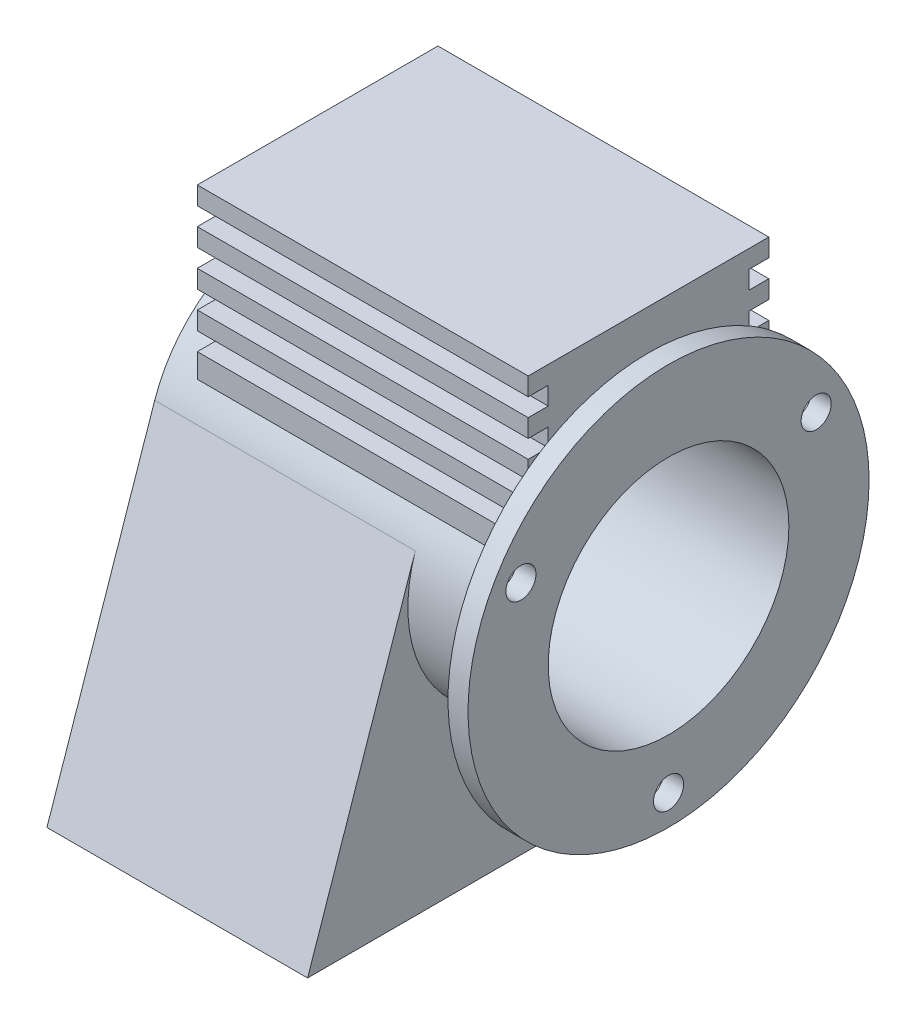
from build123d import *
from build123d.topology import SkipClean

# Parameters (mm, degrees)
BOSS_EXTRUDE1_DEPTH     = 165.1
SKETCH2_R               = 88.9
BOSS_EXTRUDE2_DEPTH     = 228.6
SKETCH3_R               = 127
BOSS_EXTRUDE3_DEPTH     = 12.7
SKETCH4_W               = 152.4
SKETCH4_H               = 152.4
BOSS_EXTRUDE4_DEPTH     = 209.55
SKETCH5_W               = 25.4
SKETCH5_H               = 11.43
CUT_EXTRUDE1_DEPTH      = 209.55
LPATTERN1_COUNT         = 4
LPATTERN1_PITCH         = 22.86
MIRROR1_COPY_1_SKETCH_W = 25.4
MIRROR1_COPY_1_SKETCH_H = 11.43
MIRROR1_COPY_1_DEPTH    = 209.55
MIRROR1_COPY_2_SKETCH_W = 25.4
MIRROR1_COPY_2_SKETCH_H = 11.43
MIRROR1_COPY_2_DEPTH    = 209.55
MIRROR1_COPY_3_SKETCH_W = 25.4
MIRROR1_COPY_3_SKETCH_H = 11.43
MIRROR1_COPY_3_DEPTH    = 209.55
SKETCH7_R               = 76.2
CUT_EXTRUDE2_DEPTH      = 228.6
SKETCH8_R               = 19.05
CUT_EXTRUDE3_DEPTH      = 228.6
SKETCH9_R               = 9.525
CUT_EXTRUDE5_DEPTH      = 50.8


with BuildPart() as part:
    # Sketch1 → Boss-Extrude1 (new body)
    with BuildSketch(Plane(origin=(0, 0, 0), x_dir=(0, 0, -1), z_dir=(1, 0, 0))):
        with BuildLine():
            Line((-152.4, -171.45), (152.4, -171.45))
            Line((152.4, -171.45), (84.14126771, 28.695941668))
            ThreePointArc((84.14126771, 28.695941668), (0, 88.9), (-84.14126771, 28.695941668))
            Line((-84.14126771, 28.695941668), (-152.4, -171.45))
        make_face()
    extrude(amount=BOSS_EXTRUDE1_DEPTH)

    # Sketch2 → Boss-Extrude2 (add)
    with SkipClean():  # the faces are left unmerged after this step: merging them gives an invalid solid
        with BuildSketch(Plane.ZY):
            Circle(SKETCH2_R)
        extrude(amount=-BOSS_EXTRUDE2_DEPTH)

    # Sketch3 → Boss-Extrude3 (add)
    with BuildSketch(Plane(origin=(228.6, 0, 0), x_dir=(0, 0, -1), z_dir=(1, 0, 0))):
        Circle(SKETCH3_R)
    extrude(amount=BOSS_EXTRUDE3_DEPTH)

    # Sketch4 → Boss-Extrude4 (add)
    with BuildSketch(Plane.ZY.offset(-228.6)):
        with Locations((0, 76.2)):
            Rectangle(SKETCH4_W, SKETCH4_H)
    extrude(amount=BOSS_EXTRUDE4_DEPTH)

    # Sketch5 → Cut-Extrude1 (cut)
    with BuildSketch(Plane.ZY.offset(-19.05)):
        with Locations((-76.2, 135.255)):
            Rectangle(SKETCH5_W, SKETCH5_H)
    cut_extrude1 = extrude(amount=-CUT_EXTRUDE1_DEPTH, mode=Mode.SUBTRACT)

    # LPattern1: Cut-Extrude1 ×4
    with Locations(*[(0, -i * LPATTERN1_PITCH, 0) for i in range(1, LPATTERN1_COUNT)]):
        add(cut_extrude1, mode=Mode.SUBTRACT)

    # Mirror1: Cut-Extrude1 across plane
    add(cut_extrude1.mirror(Plane.XY), mode=Mode.SUBTRACT)

    # Mirror1 copy 1 sketch → Mirror1 copy 1 (cut)
    with BuildSketch(Plane(origin=(19.05, -22.86, 0), x_dir=(0, 0, -1), z_dir=(-1, 0, 0))):
        with Locations((-76.2, -135.255)):
            Rectangle(MIRROR1_COPY_1_SKETCH_W, MIRROR1_COPY_1_SKETCH_H)
    extrude(amount=-MIRROR1_COPY_1_DEPTH, mode=Mode.SUBTRACT)

    # Mirror1 copy 2 sketch → Mirror1 copy 2 (cut)
    with BuildSketch(Plane(origin=(19.05, -45.72, 0), x_dir=(0, 0, -1), z_dir=(-1, 0, 0))):
        with Locations((-76.2, -135.255)):
            Rectangle(MIRROR1_COPY_2_SKETCH_W, MIRROR1_COPY_2_SKETCH_H)
    extrude(amount=-MIRROR1_COPY_2_DEPTH, mode=Mode.SUBTRACT)

    # Mirror1 copy 3 sketch → Mirror1 copy 3 (cut)
    with BuildSketch(Plane(origin=(19.05, -68.58, 0), x_dir=(0, 0, -1), z_dir=(-1, 0, 0))):
        with Locations((-76.2, -135.255)):
            Rectangle(MIRROR1_COPY_3_SKETCH_W, MIRROR1_COPY_3_SKETCH_H)
    extrude(amount=-MIRROR1_COPY_3_DEPTH, mode=Mode.SUBTRACT)

    # Sketch7 → Cut-Extrude2 (cut)
    with BuildSketch(Plane(origin=(241.3, 0, 0), x_dir=(0, 0, -1), z_dir=(1, 0, 0))):
        Circle(SKETCH7_R)
    extrude(amount=-CUT_EXTRUDE2_DEPTH, mode=Mode.SUBTRACT)

    # Sketch8 → Cut-Extrude3 (cut)
    with BuildSketch(Plane(origin=(12.7, 0, 0), x_dir=(0, 0, -1), z_dir=(1, 0, 0))):
        Circle(SKETCH8_R)
    extrude(amount=-CUT_EXTRUDE3_DEPTH, mode=Mode.SUBTRACT)

    # Sketch9 → Cut-Extrude5 (cut)
    with BuildSketch(Plane(origin=(241.3, 0, 0), x_dir=(0, 0, -1), z_dir=(1, 0, 0))):
        with Locations((0, -107.95)):
            Circle(SKETCH9_R)
        with Locations((-93.487442339, 53.975)):
            Circle(SKETCH9_R)
        with Locations((93.487442339, 53.975)):
            Circle(SKETCH9_R)
    extrude(amount=-CUT_EXTRUDE5_DEPTH, mode=Mode.SUBTRACT)


solid = part.part
